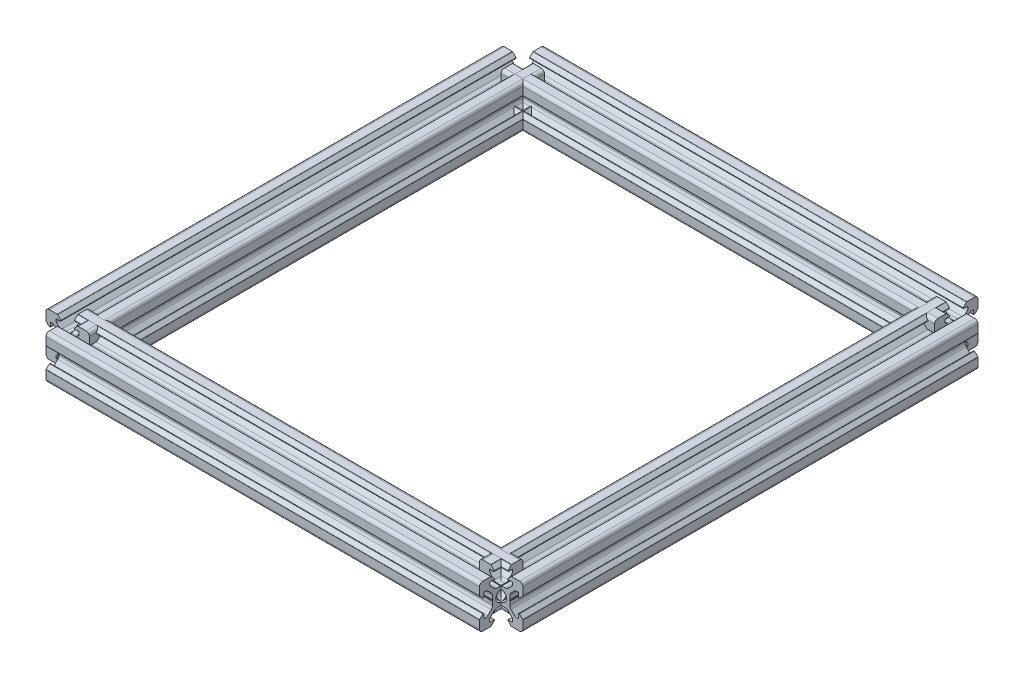
from build123d import *

# Parameters (mm, degrees)
SKETCH_531_R                  = 2.5
PROFILE_20_20_20X20_1_DEPTH   = 210
SKETCH_531_ON_SEGMENT_2_R     = 2.5
PROFILE_20_20_20X20_1_2_DEPTH = 210
SKETCH_1_R                    = 2.5
PROFILE_20_20_20X20_2_DEPTH   = 200
SKETCH_1_ON_SEGMENT_2_R       = 2.5
PROFILE_20_20_20X20_2_2_DEPTH = 200


with BuildPart() as part:
    # Sketch 531 → Profile_20х20 20X20(1) (new body)
    with BuildSketch(Plane(origin=(-100, 0, -105), x_dir=(1, 0, 0), z_dir=(0, 0, 1))):
        with BuildLine():
            Line((-4, 1.898780669), (-4, 0.337695265))
            ThreePointArc((-4, 0.337695265), (-3.98590708, 0.254943529), (-3.945217202, 0.181521503))
            Line((-3.945217202, 0.181521503), (-3.8, 0))
            Line((-3.8, 0), (-3.945217202, -0.181521503))
            ThreePointArc((-3.945217202, -0.181521503), (-3.98590708, -0.254943529), (-4, -0.337695265))
            Line((-4, -0.337695265), (-4, -1.898780669))
            ThreePointArc((-4, -1.898780669), (-4.152240935, -2.664147534), (-4.585786438, -3.312994231))
            Line((-4.585786438, -3.312994231), (-6.279898987, -5.007106781))
            ThreePointArc((-6.279898987, -5.007106781), (-6.604322336, -5.223879533), (-6.987005769, -5.3))
            Line((-6.987005769, -5.3), (-7.8, -5.3))
            ThreePointArc((-7.8, -5.3), (-7.941421356, -5.241421356), (-8, -5.1))
            Line((-8, -5.1), (-8, -3.33))
            ThreePointArc((-8, -3.33), (-8.154329142, -3.099030117), (-8.426776695, -3.153223305))
            Line((-8.426776695, -3.153223305), (-9.926776695, -4.653223305))
            ThreePointArc((-9.926776695, -4.653223305), (-9.980969883, -4.734329142), (-10, -4.83))
            Line((-10, -4.83), (-10, -8.5))
            ThreePointArc((-10, -8.5), (-9.560660172, -9.560660172), (-8.5, -10))
            Line((-8.5, -10), (-4.83, -10))
            ThreePointArc((-4.83, -10), (-4.734329142, -9.980969883), (-4.653223305, -9.926776695))
            Line((-4.653223305, -9.926776695), (-3.153223305, -8.426776695))
            ThreePointArc((-3.153223305, -8.426776695), (-3.099030117, -8.154329142), (-3.33, -8))
            Line((-3.33, -8), (-5.1, -8))
            ThreePointArc((-5.1, -8), (-5.241421356, -7.941421356), (-5.3, -7.8))
            Line((-5.3, -7.8), (-5.3, -6.987005769))
            ThreePointArc((-5.3, -6.987005769), (-5.223879533, -6.604322336), (-5.007106781, -6.279898987))
            Line((-5.007106781, -6.279898987), (-3.312994231, -4.585786438))
            ThreePointArc((-3.312994231, -4.585786438), (-2.664147534, -4.152240935), (-1.898780669, -4))
            Line((-1.898780669, -4), (-0.337695265, -4))
            ThreePointArc((-0.337695265, -4), (-0.254943529, -3.98590708), (-0.181521503, -3.945217202))
            Line((-0.181521503, -3.945217202), (0, -3.8))
            Line((0, -3.8), (0.181521503, -3.945217202))
            ThreePointArc((0.181521503, -3.945217202), (0.254943529, -3.98590708), (0.337695265, -4))
            Line((0.337695265, -4), (1.898780669, -4))
            ThreePointArc((1.898780669, -4), (2.664147534, -4.152240935), (3.312994231, -4.585786438))
            Line((3.312994231, -4.585786438), (5.007106781, -6.279898987))
            ThreePointArc((5.007106781, -6.279898987), (5.223879533, -6.604322336), (5.3, -6.987005769))
            Line((5.3, -6.987005769), (5.3, -7.8))
            ThreePointArc((5.3, -7.8), (5.241421356, -7.941421356), (5.1, -8))
            Line((5.1, -8), (3.33, -8))
            ThreePointArc((3.33, -8), (3.099030117, -8.154329142), (3.153223305, -8.426776695))
            Line((3.153223305, -8.426776695), (4.653223305, -9.926776695))
            ThreePointArc((4.653223305, -9.926776695), (4.734329142, -9.980969883), (4.83, -10))
            Line((4.83, -10), (8.5, -10))
            ThreePointArc((8.5, -10), (9.560660172, -9.560660172), (10, -8.5))
            Line((10, -8.5), (10, -4.83))
            ThreePointArc((10, -4.83), (9.980969883, -4.734329142), (9.926776695, -4.653223305))
            Line((9.926776695, -4.653223305), (8.426776695, -3.153223305))
            ThreePointArc((8.426776695, -3.153223305), (8.154329142, -3.099030117), (8, -3.33))
            Line((8, -3.33), (8, -5.1))
            ThreePointArc((8, -5.1), (7.941421356, -5.241421356), (7.8, -5.3))
            Line((7.8, -5.3), (6.987005769, -5.3))
            ThreePointArc((6.987005769, -5.3), (6.604322336, -5.223879533), (6.279898987, -5.007106781))
            Line((6.279898987, -5.007106781), (4.585786438, -3.312994231))
            ThreePointArc((4.585786438, -3.312994231), (4.152240935, -2.664147534), (4, -1.898780669))
            Line((4, -1.898780669), (4, -0.337695265))
            ThreePointArc((4, -0.337695265), (3.98590708, -0.254943529), (3.945217202, -0.181521503))
            Line((3.945217202, -0.181521503), (3.8, 0))
            Line((3.8, 0), (3.945217202, 0.181521503))
            ThreePointArc((3.945217202, 0.181521503), (3.98590708, 0.254943529), (4, 0.337695265))
            Line((4, 0.337695265), (4, 1.898780669))
            ThreePointArc((4, 1.898780669), (4.152240935, 2.664147534), (4.585786438, 3.312994231))
            Line((4.585786438, 3.312994231), (6.279898987, 5.007106781))
            ThreePointArc((6.279898987, 5.007106781), (6.604322336, 5.223879533), (6.987005769, 5.3))
            Line((6.987005769, 5.3), (7.8, 5.3))
            ThreePointArc((7.8, 5.3), (7.941421356, 5.241421356), (8, 5.1))
            Line((8, 5.1), (8, 3.33))
            ThreePointArc((8, 3.33), (8.154329142, 3.099030117), (8.426776695, 3.153223305))
            Line((8.426776695, 3.153223305), (9.926776695, 4.653223305))
            ThreePointArc((9.926776695, 4.653223305), (9.980969883, 4.734329142), (10, 4.83))
            Line((10, 4.83), (10, 8.5))
            ThreePointArc((10, 8.5), (9.560660172, 9.560660172), (8.5, 10))
            Line((8.5, 10), (4.83, 10))
            ThreePointArc((4.83, 10), (4.734329142, 9.980969883), (4.653223305, 9.926776695))
            Line((4.653223305, 9.926776695), (3.153223305, 8.426776695))
            ThreePointArc((3.153223305, 8.426776695), (3.099030117, 8.154329142), (3.33, 8))
            Line((3.33, 8), (5.1, 8))
            ThreePointArc((5.1, 8), (5.241421356, 7.941421356), (5.3, 7.8))
            Line((5.3, 7.8), (5.3, 6.987005769))
            ThreePointArc((5.3, 6.987005769), (5.223879533, 6.604322336), (5.007106781, 6.279898987))
            Line((5.007106781, 6.279898987), (3.312994231, 4.585786438))
            ThreePointArc((3.312994231, 4.585786438), (2.664147534, 4.152240935), (1.898780669, 4))
            Line((1.898780669, 4), (0.337695265, 4))
            ThreePointArc((0.337695265, 4), (0.254943529, 3.98590708), (0.181521503, 3.945217202))
            Line((0.181521503, 3.945217202), (0, 3.8))
            Line((0, 3.8), (-0.181521503, 3.945217202))
            ThreePointArc((-0.181521503, 3.945217202), (-0.254943529, 3.98590708), (-0.337695265, 4))
            Line((-0.337695265, 4), (-1.898780669, 4))
            ThreePointArc((-1.898780669, 4), (-2.664147534, 4.152240935), (-3.312994231, 4.585786438))
            Line((-3.312994231, 4.585786438), (-5.007106781, 6.279898987))
            ThreePointArc((-5.007106781, 6.279898987), (-5.223879533, 6.604322336), (-5.3, 6.987005769))
            Line((-5.3, 6.987005769), (-5.3, 7.8))
            ThreePointArc((-5.3, 7.8), (-5.241421356, 7.941421356), (-5.1, 8))
            Line((-5.1, 8), (-3.33, 8))
            ThreePointArc((-3.33, 8), (-3.099030117, 8.154329142), (-3.153223305, 8.426776695))
            Line((-3.153223305, 8.426776695), (-4.653223305, 9.926776695))
            ThreePointArc((-4.653223305, 9.926776695), (-4.734329142, 9.980969883), (-4.83, 10))
            Line((-4.83, 10), (-8.5, 10))
            ThreePointArc((-8.5, 10), (-9.560660172, 9.560660172), (-10, 8.5))
            Line((-10, 8.5), (-10, 4.83))
            ThreePointArc((-10, 4.83), (-9.980969883, 4.734329142), (-9.926776695, 4.653223305))
            Line((-9.926776695, 4.653223305), (-8.426776695, 3.153223305))
            ThreePointArc((-8.426776695, 3.153223305), (-8.154329142, 3.099030117), (-8, 3.33))
            Line((-8, 3.33), (-8, 5.1))
            ThreePointArc((-8, 5.1), (-7.941421356, 5.241421356), (-7.8, 5.3))
            Line((-7.8, 5.3), (-6.987005769, 5.3))
            ThreePointArc((-6.987005769, 5.3), (-6.604322336, 5.223879533), (-6.279898987, 5.007106781))
            Line((-6.279898987, 5.007106781), (-4.585786438, 3.312994231))
            ThreePointArc((-4.585786438, 3.312994231), (-4.152240935, 2.664147534), (-4, 1.898780669))
        make_face()
        Circle(SKETCH_531_R, mode=Mode.SUBTRACT)
    extrude(amount=PROFILE_20_20_20X20_1_DEPTH)


with BuildPart() as body_2:
    # Sketch 531 on segment 2 (carried to segment 2) → Profile_20_20 20X20_1 2 (new body)
    with BuildSketch(Plane(origin=(100, 0, -105), x_dir=(1, 0, 0), z_dir=(0, 0, 1))):
        with BuildLine():
            Line((-4, 1.898780669), (-4, 0.337695265))
            ThreePointArc((-4, 0.337695265), (-3.98590708, 0.254943529), (-3.945217202, 0.181521503))
            Line((-3.945217202, 0.181521503), (-3.8, 0))
            Line((-3.8, 0), (-3.945217202, -0.181521503))
            ThreePointArc((-3.945217202, -0.181521503), (-3.98590708, -0.254943529), (-4, -0.337695265))
            Line((-4, -0.337695265), (-4, -1.898780669))
            ThreePointArc((-4, -1.898780669), (-4.152240935, -2.664147534), (-4.585786438, -3.312994231))
            Line((-4.585786438, -3.312994231), (-6.279898987, -5.007106781))
            ThreePointArc((-6.279898987, -5.007106781), (-6.604322336, -5.223879533), (-6.987005769, -5.3))
            Line((-6.987005769, -5.3), (-7.8, -5.3))
            ThreePointArc((-7.8, -5.3), (-7.941421356, -5.241421356), (-8, -5.1))
            Line((-8, -5.1), (-8, -3.33))
            ThreePointArc((-8, -3.33), (-8.154329142, -3.099030117), (-8.426776695, -3.153223305))
            Line((-8.426776695, -3.153223305), (-9.926776695, -4.653223305))
            ThreePointArc((-9.926776695, -4.653223305), (-9.980969883, -4.734329142), (-10, -4.83))
            Line((-10, -4.83), (-10, -8.5))
            ThreePointArc((-10, -8.5), (-9.560660172, -9.560660172), (-8.5, -10))
            Line((-8.5, -10), (-4.83, -10))
            ThreePointArc((-4.83, -10), (-4.734329142, -9.980969883), (-4.653223305, -9.926776695))
            Line((-4.653223305, -9.926776695), (-3.153223305, -8.426776695))
            ThreePointArc((-3.153223305, -8.426776695), (-3.099030117, -8.154329142), (-3.33, -8))
            Line((-3.33, -8), (-5.1, -8))
            ThreePointArc((-5.1, -8), (-5.241421356, -7.941421356), (-5.3, -7.8))
            Line((-5.3, -7.8), (-5.3, -6.987005769))
            ThreePointArc((-5.3, -6.987005769), (-5.223879533, -6.604322336), (-5.007106781, -6.279898987))
            Line((-5.007106781, -6.279898987), (-3.312994231, -4.585786438))
            ThreePointArc((-3.312994231, -4.585786438), (-2.664147534, -4.152240935), (-1.898780669, -4))
            Line((-1.898780669, -4), (-0.337695265, -4))
            ThreePointArc((-0.337695265, -4), (-0.254943529, -3.98590708), (-0.181521503, -3.945217202))
            Line((-0.181521503, -3.945217202), (0, -3.8))
            Line((0, -3.8), (0.181521503, -3.945217202))
            ThreePointArc((0.181521503, -3.945217202), (0.254943529, -3.98590708), (0.337695265, -4))
            Line((0.337695265, -4), (1.898780669, -4))
            ThreePointArc((1.898780669, -4), (2.664147534, -4.152240935), (3.312994231, -4.585786438))
            Line((3.312994231, -4.585786438), (5.007106781, -6.279898987))
            ThreePointArc((5.007106781, -6.279898987), (5.223879533, -6.604322336), (5.3, -6.987005769))
            Line((5.3, -6.987005769), (5.3, -7.8))
            ThreePointArc((5.3, -7.8), (5.241421356, -7.941421356), (5.1, -8))
            Line((5.1, -8), (3.33, -8))
            ThreePointArc((3.33, -8), (3.099030117, -8.154329142), (3.153223305, -8.426776695))
            Line((3.153223305, -8.426776695), (4.653223305, -9.926776695))
            ThreePointArc((4.653223305, -9.926776695), (4.734329142, -9.980969883), (4.83, -10))
            Line((4.83, -10), (8.5, -10))
            ThreePointArc((8.5, -10), (9.560660172, -9.560660172), (10, -8.5))
            Line((10, -8.5), (10, -4.83))
            ThreePointArc((10, -4.83), (9.980969883, -4.734329142), (9.926776695, -4.653223305))
            Line((9.926776695, -4.653223305), (8.426776695, -3.153223305))
            ThreePointArc((8.426776695, -3.153223305), (8.154329142, -3.099030117), (8, -3.33))
            Line((8, -3.33), (8, -5.1))
            ThreePointArc((8, -5.1), (7.941421356, -5.241421356), (7.8, -5.3))
            Line((7.8, -5.3), (6.987005769, -5.3))
            ThreePointArc((6.987005769, -5.3), (6.604322336, -5.223879533), (6.279898987, -5.007106781))
            Line((6.279898987, -5.007106781), (4.585786438, -3.312994231))
            ThreePointArc((4.585786438, -3.312994231), (4.152240935, -2.664147534), (4, -1.898780669))
            Line((4, -1.898780669), (4, -0.337695265))
            ThreePointArc((4, -0.337695265), (3.98590708, -0.254943529), (3.945217202, -0.181521503))
            Line((3.945217202, -0.181521503), (3.8, 0))
            Line((3.8, 0), (3.945217202, 0.181521503))
            ThreePointArc((3.945217202, 0.181521503), (3.98590708, 0.254943529), (4, 0.337695265))
            Line((4, 0.337695265), (4, 1.898780669))
            ThreePointArc((4, 1.898780669), (4.152240935, 2.664147534), (4.585786438, 3.312994231))
            Line((4.585786438, 3.312994231), (6.279898987, 5.007106781))
            ThreePointArc((6.279898987, 5.007106781), (6.604322336, 5.223879533), (6.987005769, 5.3))
            Line((6.987005769, 5.3), (7.8, 5.3))
            ThreePointArc((7.8, 5.3), (7.941421356, 5.241421356), (8, 5.1))
            Line((8, 5.1), (8, 3.33))
            ThreePointArc((8, 3.33), (8.154329142, 3.099030117), (8.426776695, 3.153223305))
            Line((8.426776695, 3.153223305), (9.926776695, 4.653223305))
            ThreePointArc((9.926776695, 4.653223305), (9.980969883, 4.734329142), (10, 4.83))
            Line((10, 4.83), (10, 8.5))
            ThreePointArc((10, 8.5), (9.560660172, 9.560660172), (8.5, 10))
            Line((8.5, 10), (4.83, 10))
            ThreePointArc((4.83, 10), (4.734329142, 9.980969883), (4.653223305, 9.926776695))
            Line((4.653223305, 9.926776695), (3.153223305, 8.426776695))
            ThreePointArc((3.153223305, 8.426776695), (3.099030117, 8.154329142), (3.33, 8))
            Line((3.33, 8), (5.1, 8))
            ThreePointArc((5.1, 8), (5.241421356, 7.941421356), (5.3, 7.8))
            Line((5.3, 7.8), (5.3, 6.987005769))
            ThreePointArc((5.3, 6.987005769), (5.223879533, 6.604322336), (5.007106781, 6.279898987))
            Line((5.007106781, 6.279898987), (3.312994231, 4.585786438))
            ThreePointArc((3.312994231, 4.585786438), (2.664147534, 4.152240935), (1.898780669, 4))
            Line((1.898780669, 4), (0.337695265, 4))
            ThreePointArc((0.337695265, 4), (0.254943529, 3.98590708), (0.181521503, 3.945217202))
            Line((0.181521503, 3.945217202), (0, 3.8))
            Line((0, 3.8), (-0.181521503, 3.945217202))
            ThreePointArc((-0.181521503, 3.945217202), (-0.254943529, 3.98590708), (-0.337695265, 4))
            Line((-0.337695265, 4), (-1.898780669, 4))
            ThreePointArc((-1.898780669, 4), (-2.664147534, 4.152240935), (-3.312994231, 4.585786438))
            Line((-3.312994231, 4.585786438), (-5.007106781, 6.279898987))
            ThreePointArc((-5.007106781, 6.279898987), (-5.223879533, 6.604322336), (-5.3, 6.987005769))
            Line((-5.3, 6.987005769), (-5.3, 7.8))
            ThreePointArc((-5.3, 7.8), (-5.241421356, 7.941421356), (-5.1, 8))
            Line((-5.1, 8), (-3.33, 8))
            ThreePointArc((-3.33, 8), (-3.099030117, 8.154329142), (-3.153223305, 8.426776695))
            Line((-3.153223305, 8.426776695), (-4.653223305, 9.926776695))
            ThreePointArc((-4.653223305, 9.926776695), (-4.734329142, 9.980969883), (-4.83, 10))
            Line((-4.83, 10), (-8.5, 10))
            ThreePointArc((-8.5, 10), (-9.560660172, 9.560660172), (-10, 8.5))
            Line((-10, 8.5), (-10, 4.83))
            ThreePointArc((-10, 4.83), (-9.980969883, 4.734329142), (-9.926776695, 4.653223305))
            Line((-9.926776695, 4.653223305), (-8.426776695, 3.153223305))
            ThreePointArc((-8.426776695, 3.153223305), (-8.154329142, 3.099030117), (-8, 3.33))
            Line((-8, 3.33), (-8, 5.1))
            ThreePointArc((-8, 5.1), (-7.941421356, 5.241421356), (-7.8, 5.3))
            Line((-7.8, 5.3), (-6.987005769, 5.3))
            ThreePointArc((-6.987005769, 5.3), (-6.604322336, 5.223879533), (-6.279898987, 5.007106781))
            Line((-6.279898987, 5.007106781), (-4.585786438, 3.312994231))
            ThreePointArc((-4.585786438, 3.312994231), (-4.152240935, 2.664147534), (-4, 1.898780669))
        make_face()
        Circle(SKETCH_531_ON_SEGMENT_2_R, mode=Mode.SUBTRACT)
    extrude(amount=PROFILE_20_20_20X20_1_2_DEPTH)


with BuildPart() as body_3:
    # Сечение1 → Profile_20х20 20X20(2) (new body)
    with BuildSketch(Plane(origin=(-100, 0, 105), x_dir=(0, 0, -1), z_dir=(1, 0, 0))):
        with BuildLine():
            Line((-4, 1.898780669), (-4, 0.337695265))
            ThreePointArc((-4, 0.337695265), (-3.98590708, 0.254943529), (-3.945217202, 0.181521503))
            Line((-3.945217202, 0.181521503), (-3.8, 0))
            Line((-3.8, 0), (-3.945217202, -0.181521503))
            ThreePointArc((-3.945217202, -0.181521503), (-3.98590708, -0.254943529), (-4, -0.337695265))
            Line((-4, -0.337695265), (-4, -1.898780669))
            ThreePointArc((-4, -1.898780669), (-4.152240935, -2.664147534), (-4.585786438, -3.312994231))
            Line((-4.585786438, -3.312994231), (-6.279898987, -5.007106781))
            ThreePointArc((-6.279898987, -5.007106781), (-6.604322336, -5.223879533), (-6.987005769, -5.3))
            Line((-6.987005769, -5.3), (-7.8, -5.3))
            ThreePointArc((-7.8, -5.3), (-7.941421356, -5.241421356), (-8, -5.1))
            Line((-8, -5.1), (-8, -3.33))
            ThreePointArc((-8, -3.33), (-8.154329142, -3.099030117), (-8.426776695, -3.153223305))
            Line((-8.426776695, -3.153223305), (-9.926776695, -4.653223305))
            ThreePointArc((-9.926776695, -4.653223305), (-9.980969883, -4.734329142), (-10, -4.83))
            Line((-10, -4.83), (-10, -8.5))
            ThreePointArc((-10, -8.5), (-9.560660172, -9.560660172), (-8.5, -10))
            Line((-8.5, -10), (-4.83, -10))
            ThreePointArc((-4.83, -10), (-4.734329142, -9.980969883), (-4.653223305, -9.926776695))
            Line((-4.653223305, -9.926776695), (-3.153223305, -8.426776695))
            ThreePointArc((-3.153223305, -8.426776695), (-3.099030117, -8.154329142), (-3.33, -8))
            Line((-3.33, -8), (-5.1, -8))
            ThreePointArc((-5.1, -8), (-5.241421356, -7.941421356), (-5.3, -7.8))
            Line((-5.3, -7.8), (-5.3, -6.987005769))
            ThreePointArc((-5.3, -6.987005769), (-5.223879533, -6.604322336), (-5.007106781, -6.279898987))
            Line((-5.007106781, -6.279898987), (-3.312994231, -4.585786438))
            ThreePointArc((-3.312994231, -4.585786438), (-2.664147534, -4.152240935), (-1.898780669, -4))
            Line((-1.898780669, -4), (-0.337695265, -4))
            ThreePointArc((-0.337695265, -4), (-0.254943529, -3.98590708), (-0.181521503, -3.945217202))
            Line((-0.181521503, -3.945217202), (0, -3.8))
            Line((0, -3.8), (0.181521503, -3.945217202))
            ThreePointArc((0.181521503, -3.945217202), (0.254943529, -3.98590708), (0.337695265, -4))
            Line((0.337695265, -4), (1.898780669, -4))
            ThreePointArc((1.898780669, -4), (2.664147534, -4.152240935), (3.312994231, -4.585786438))
            Line((3.312994231, -4.585786438), (5.007106781, -6.279898987))
            ThreePointArc((5.007106781, -6.279898987), (5.223879533, -6.604322336), (5.3, -6.987005769))
            Line((5.3, -6.987005769), (5.3, -7.8))
            ThreePointArc((5.3, -7.8), (5.241421356, -7.941421356), (5.1, -8))
            Line((5.1, -8), (3.33, -8))
            ThreePointArc((3.33, -8), (3.099030117, -8.154329142), (3.153223305, -8.426776695))
            Line((3.153223305, -8.426776695), (4.653223305, -9.926776695))
            ThreePointArc((4.653223305, -9.926776695), (4.734329142, -9.980969883), (4.83, -10))
            Line((4.83, -10), (8.5, -10))
            ThreePointArc((8.5, -10), (9.560660172, -9.560660172), (10, -8.5))
            Line((10, -8.5), (10, -4.83))
            ThreePointArc((10, -4.83), (9.980969883, -4.734329142), (9.926776695, -4.653223305))
            Line((9.926776695, -4.653223305), (8.426776695, -3.153223305))
            ThreePointArc((8.426776695, -3.153223305), (8.154329142, -3.099030117), (8, -3.33))
            Line((8, -3.33), (8, -5.1))
            ThreePointArc((8, -5.1), (7.941421356, -5.241421356), (7.8, -5.3))
            Line((7.8, -5.3), (6.987005769, -5.3))
            ThreePointArc((6.987005769, -5.3), (6.604322336, -5.223879533), (6.279898987, -5.007106781))
            Line((6.279898987, -5.007106781), (4.585786438, -3.312994231))
            ThreePointArc((4.585786438, -3.312994231), (4.152240935, -2.664147534), (4, -1.898780669))
            Line((4, -1.898780669), (4, -0.337695265))
            ThreePointArc((4, -0.337695265), (3.98590708, -0.254943529), (3.945217202, -0.181521503))
            Line((3.945217202, -0.181521503), (3.8, 0))
            Line((3.8, 0), (3.945217202, 0.181521503))
            ThreePointArc((3.945217202, 0.181521503), (3.98590708, 0.254943529), (4, 0.337695265))
            Line((4, 0.337695265), (4, 1.898780669))
            ThreePointArc((4, 1.898780669), (4.152240935, 2.664147534), (4.585786438, 3.312994231))
            Line((4.585786438, 3.312994231), (6.279898987, 5.007106781))
            ThreePointArc((6.279898987, 5.007106781), (6.604322336, 5.223879533), (6.987005769, 5.3))
            Line((6.987005769, 5.3), (7.8, 5.3))
            ThreePointArc((7.8, 5.3), (7.941421356, 5.241421356), (8, 5.1))
            Line((8, 5.1), (8, 3.33))
            ThreePointArc((8, 3.33), (8.154329142, 3.099030117), (8.426776695, 3.153223305))
            Line((8.426776695, 3.153223305), (9.926776695, 4.653223305))
            ThreePointArc((9.926776695, 4.653223305), (9.980969883, 4.734329142), (10, 4.83))
            Line((10, 4.83), (10, 8.5))
            ThreePointArc((10, 8.5), (9.560660172, 9.560660172), (8.5, 10))
            Line((8.5, 10), (4.83, 10))
            ThreePointArc((4.83, 10), (4.734329142, 9.980969883), (4.653223305, 9.926776695))
            Line((4.653223305, 9.926776695), (3.153223305, 8.426776695))
            ThreePointArc((3.153223305, 8.426776695), (3.099030117, 8.154329142), (3.33, 8))
            Line((3.33, 8), (5.1, 8))
            ThreePointArc((5.1, 8), (5.241421356, 7.941421356), (5.3, 7.8))
            Line((5.3, 7.8), (5.3, 6.987005769))
            ThreePointArc((5.3, 6.987005769), (5.223879533, 6.604322336), (5.007106781, 6.279898987))
            Line((5.007106781, 6.279898987), (3.312994231, 4.585786438))
            ThreePointArc((3.312994231, 4.585786438), (2.664147534, 4.152240935), (1.898780669, 4))
            Line((1.898780669, 4), (0.337695265, 4))
            ThreePointArc((0.337695265, 4), (0.254943529, 3.98590708), (0.181521503, 3.945217202))
            Line((0.181521503, 3.945217202), (0, 3.8))
            Line((0, 3.8), (-0.181521503, 3.945217202))
            ThreePointArc((-0.181521503, 3.945217202), (-0.254943529, 3.98590708), (-0.337695265, 4))
            Line((-0.337695265, 4), (-1.898780669, 4))
            ThreePointArc((-1.898780669, 4), (-2.664147534, 4.152240935), (-3.312994231, 4.585786438))
            Line((-3.312994231, 4.585786438), (-5.007106781, 6.279898987))
            ThreePointArc((-5.007106781, 6.279898987), (-5.223879533, 6.604322336), (-5.3, 6.987005769))
            Line((-5.3, 6.987005769), (-5.3, 7.8))
            ThreePointArc((-5.3, 7.8), (-5.241421356, 7.941421356), (-5.1, 8))
            Line((-5.1, 8), (-3.33, 8))
            ThreePointArc((-3.33, 8), (-3.099030117, 8.154329142), (-3.153223305, 8.426776695))
            Line((-3.153223305, 8.426776695), (-4.653223305, 9.926776695))
            ThreePointArc((-4.653223305, 9.926776695), (-4.734329142, 9.980969883), (-4.83, 10))
            Line((-4.83, 10), (-8.5, 10))
            ThreePointArc((-8.5, 10), (-9.560660172, 9.560660172), (-10, 8.5))
            Line((-10, 8.5), (-10, 4.83))
            ThreePointArc((-10, 4.83), (-9.980969883, 4.734329142), (-9.926776695, 4.653223305))
            Line((-9.926776695, 4.653223305), (-8.426776695, 3.153223305))
            ThreePointArc((-8.426776695, 3.153223305), (-8.154329142, 3.099030117), (-8, 3.33))
            Line((-8, 3.33), (-8, 5.1))
            ThreePointArc((-8, 5.1), (-7.941421356, 5.241421356), (-7.8, 5.3))
            Line((-7.8, 5.3), (-6.987005769, 5.3))
            ThreePointArc((-6.987005769, 5.3), (-6.604322336, 5.223879533), (-6.279898987, 5.007106781))
            Line((-6.279898987, 5.007106781), (-4.585786438, 3.312994231))
            ThreePointArc((-4.585786438, 3.312994231), (-4.152240935, 2.664147534), (-4, 1.898780669))
        make_face()
        Circle(SKETCH_1_R, mode=Mode.SUBTRACT)
    extrude(amount=PROFILE_20_20_20X20_2_DEPTH)


with BuildPart() as body_4:
    # Сечение1 on segment 2 (carried to segment 2) → Profile_20_20 20X20_2 2 (new body)
    with BuildSketch(Plane(origin=(-100, 0, -105), x_dir=(0, 0, -1), z_dir=(1, 0, 0))):
        with BuildLine():
            Line((-4, 1.898780669), (-4, 0.337695265))
            ThreePointArc((-4, 0.337695265), (-3.98590708, 0.254943529), (-3.945217202, 0.181521503))
            Line((-3.945217202, 0.181521503), (-3.8, 0))
            Line((-3.8, 0), (-3.945217202, -0.181521503))
            ThreePointArc((-3.945217202, -0.181521503), (-3.98590708, -0.254943529), (-4, -0.337695265))
            Line((-4, -0.337695265), (-4, -1.898780669))
            ThreePointArc((-4, -1.898780669), (-4.152240935, -2.664147534), (-4.585786438, -3.312994231))
            Line((-4.585786438, -3.312994231), (-6.279898987, -5.007106781))
            ThreePointArc((-6.279898987, -5.007106781), (-6.604322336, -5.223879533), (-6.987005769, -5.3))
            Line((-6.987005769, -5.3), (-7.8, -5.3))
            ThreePointArc((-7.8, -5.3), (-7.941421356, -5.241421356), (-8, -5.1))
            Line((-8, -5.1), (-8, -3.33))
            ThreePointArc((-8, -3.33), (-8.154329142, -3.099030117), (-8.426776695, -3.153223305))
            Line((-8.426776695, -3.153223305), (-9.926776695, -4.653223305))
            ThreePointArc((-9.926776695, -4.653223305), (-9.980969883, -4.734329142), (-10, -4.83))
            Line((-10, -4.83), (-10, -8.5))
            ThreePointArc((-10, -8.5), (-9.560660172, -9.560660172), (-8.5, -10))
            Line((-8.5, -10), (-4.83, -10))
            ThreePointArc((-4.83, -10), (-4.734329142, -9.980969883), (-4.653223305, -9.926776695))
            Line((-4.653223305, -9.926776695), (-3.153223305, -8.426776695))
            ThreePointArc((-3.153223305, -8.426776695), (-3.099030117, -8.154329142), (-3.33, -8))
            Line((-3.33, -8), (-5.1, -8))
            ThreePointArc((-5.1, -8), (-5.241421356, -7.941421356), (-5.3, -7.8))
            Line((-5.3, -7.8), (-5.3, -6.987005769))
            ThreePointArc((-5.3, -6.987005769), (-5.223879533, -6.604322336), (-5.007106781, -6.279898987))
            Line((-5.007106781, -6.279898987), (-3.312994231, -4.585786438))
            ThreePointArc((-3.312994231, -4.585786438), (-2.664147534, -4.152240935), (-1.898780669, -4))
            Line((-1.898780669, -4), (-0.337695265, -4))
            ThreePointArc((-0.337695265, -4), (-0.254943529, -3.98590708), (-0.181521503, -3.945217202))
            Line((-0.181521503, -3.945217202), (0, -3.8))
            Line((0, -3.8), (0.181521503, -3.945217202))
            ThreePointArc((0.181521503, -3.945217202), (0.254943529, -3.98590708), (0.337695265, -4))
            Line((0.337695265, -4), (1.898780669, -4))
            ThreePointArc((1.898780669, -4), (2.664147534, -4.152240935), (3.312994231, -4.585786438))
            Line((3.312994231, -4.585786438), (5.007106781, -6.279898987))
            ThreePointArc((5.007106781, -6.279898987), (5.223879533, -6.604322336), (5.3, -6.987005769))
            Line((5.3, -6.987005769), (5.3, -7.8))
            ThreePointArc((5.3, -7.8), (5.241421356, -7.941421356), (5.1, -8))
            Line((5.1, -8), (3.33, -8))
            ThreePointArc((3.33, -8), (3.099030117, -8.154329142), (3.153223305, -8.426776695))
            Line((3.153223305, -8.426776695), (4.653223305, -9.926776695))
            ThreePointArc((4.653223305, -9.926776695), (4.734329142, -9.980969883), (4.83, -10))
            Line((4.83, -10), (8.5, -10))
            ThreePointArc((8.5, -10), (9.560660172, -9.560660172), (10, -8.5))
            Line((10, -8.5), (10, -4.83))
            ThreePointArc((10, -4.83), (9.980969883, -4.734329142), (9.926776695, -4.653223305))
            Line((9.926776695, -4.653223305), (8.426776695, -3.153223305))
            ThreePointArc((8.426776695, -3.153223305), (8.154329142, -3.099030117), (8, -3.33))
            Line((8, -3.33), (8, -5.1))
            ThreePointArc((8, -5.1), (7.941421356, -5.241421356), (7.8, -5.3))
            Line((7.8, -5.3), (6.987005769, -5.3))
            ThreePointArc((6.987005769, -5.3), (6.604322336, -5.223879533), (6.279898987, -5.007106781))
            Line((6.279898987, -5.007106781), (4.585786438, -3.312994231))
            ThreePointArc((4.585786438, -3.312994231), (4.152240935, -2.664147534), (4, -1.898780669))
            Line((4, -1.898780669), (4, -0.337695265))
            ThreePointArc((4, -0.337695265), (3.98590708, -0.254943529), (3.945217202, -0.181521503))
            Line((3.945217202, -0.181521503), (3.8, 0))
            Line((3.8, 0), (3.945217202, 0.181521503))
            ThreePointArc((3.945217202, 0.181521503), (3.98590708, 0.254943529), (4, 0.337695265))
            Line((4, 0.337695265), (4, 1.898780669))
            ThreePointArc((4, 1.898780669), (4.152240935, 2.664147534), (4.585786438, 3.312994231))
            Line((4.585786438, 3.312994231), (6.279898987, 5.007106781))
            ThreePointArc((6.279898987, 5.007106781), (6.604322336, 5.223879533), (6.987005769, 5.3))
            Line((6.987005769, 5.3), (7.8, 5.3))
            ThreePointArc((7.8, 5.3), (7.941421356, 5.241421356), (8, 5.1))
            Line((8, 5.1), (8, 3.33))
            ThreePointArc((8, 3.33), (8.154329142, 3.099030117), (8.426776695, 3.153223305))
            Line((8.426776695, 3.153223305), (9.926776695, 4.653223305))
            ThreePointArc((9.926776695, 4.653223305), (9.980969883, 4.734329142), (10, 4.83))
            Line((10, 4.83), (10, 8.5))
            ThreePointArc((10, 8.5), (9.560660172, 9.560660172), (8.5, 10))
            Line((8.5, 10), (4.83, 10))
            ThreePointArc((4.83, 10), (4.734329142, 9.980969883), (4.653223305, 9.926776695))
            Line((4.653223305, 9.926776695), (3.153223305, 8.426776695))
            ThreePointArc((3.153223305, 8.426776695), (3.099030117, 8.154329142), (3.33, 8))
            Line((3.33, 8), (5.1, 8))
            ThreePointArc((5.1, 8), (5.241421356, 7.941421356), (5.3, 7.8))
            Line((5.3, 7.8), (5.3, 6.987005769))
            ThreePointArc((5.3, 6.987005769), (5.223879533, 6.604322336), (5.007106781, 6.279898987))
            Line((5.007106781, 6.279898987), (3.312994231, 4.585786438))
            ThreePointArc((3.312994231, 4.585786438), (2.664147534, 4.152240935), (1.898780669, 4))
            Line((1.898780669, 4), (0.337695265, 4))
            ThreePointArc((0.337695265, 4), (0.254943529, 3.98590708), (0.181521503, 3.945217202))
            Line((0.181521503, 3.945217202), (0, 3.8))
            Line((0, 3.8), (-0.181521503, 3.945217202))
            ThreePointArc((-0.181521503, 3.945217202), (-0.254943529, 3.98590708), (-0.337695265, 4))
            Line((-0.337695265, 4), (-1.898780669, 4))
            ThreePointArc((-1.898780669, 4), (-2.664147534, 4.152240935), (-3.312994231, 4.585786438))
            Line((-3.312994231, 4.585786438), (-5.007106781, 6.279898987))
            ThreePointArc((-5.007106781, 6.279898987), (-5.223879533, 6.604322336), (-5.3, 6.987005769))
            Line((-5.3, 6.987005769), (-5.3, 7.8))
            ThreePointArc((-5.3, 7.8), (-5.241421356, 7.941421356), (-5.1, 8))
            Line((-5.1, 8), (-3.33, 8))
            ThreePointArc((-3.33, 8), (-3.099030117, 8.154329142), (-3.153223305, 8.426776695))
            Line((-3.153223305, 8.426776695), (-4.653223305, 9.926776695))
            ThreePointArc((-4.653223305, 9.926776695), (-4.734329142, 9.980969883), (-4.83, 10))
            Line((-4.83, 10), (-8.5, 10))
            ThreePointArc((-8.5, 10), (-9.560660172, 9.560660172), (-10, 8.5))
            Line((-10, 8.5), (-10, 4.83))
            ThreePointArc((-10, 4.83), (-9.980969883, 4.734329142), (-9.926776695, 4.653223305))
            Line((-9.926776695, 4.653223305), (-8.426776695, 3.153223305))
            ThreePointArc((-8.426776695, 3.153223305), (-8.154329142, 3.099030117), (-8, 3.33))
            Line((-8, 3.33), (-8, 5.1))
            ThreePointArc((-8, 5.1), (-7.941421356, 5.241421356), (-7.8, 5.3))
            Line((-7.8, 5.3), (-6.987005769, 5.3))
            ThreePointArc((-6.987005769, 5.3), (-6.604322336, 5.223879533), (-6.279898987, 5.007106781))
            Line((-6.279898987, 5.007106781), (-4.585786438, 3.312994231))
            ThreePointArc((-4.585786438, 3.312994231), (-4.152240935, 2.664147534), (-4, 1.898780669))
        make_face()
        Circle(SKETCH_1_ON_SEGMENT_2_R, mode=Mode.SUBTRACT)
    extrude(amount=PROFILE_20_20_20X20_2_2_DEPTH)


solid = Compound([part.part, body_2.part, body_3.part, body_4.part])
